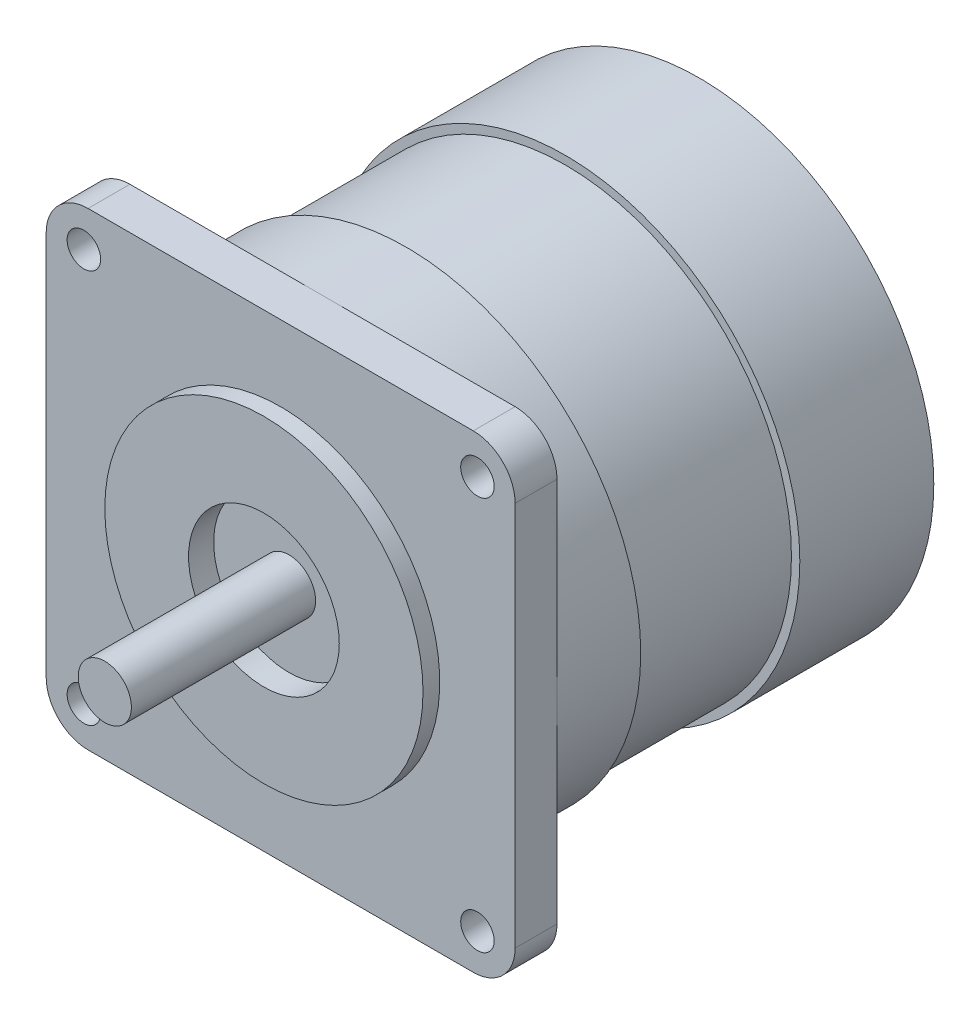
from build123d import *

# Parameters (mm, degrees)
ESQUISSE1_W             = 56
ESQUISSE1_H             = 56
BOSS_EXTRU_1_DEPTH      = 5
ESQUISSE3_R             = 19
BOSS_EXTRU_2_DEPTH      = 2
ESQUISSE4_R             = 9
ENL_V_MAT_EXTRU_1_DEPTH = 3
ESQUISSE5_R             = 3.175
BOSS_EXTRU_3_DEPTH      = 22
ENL_V_MAT_EXTRU_2_REACH = 65.781
ESQUISSE6_R             = 2
CONG_1_R                = 5


with BuildPart() as part:
    # Esquisse1 → Boss.-Extru.1 (new body)
    with BuildSketch(Plane.XY):
        Rectangle(ESQUISSE1_W, ESQUISSE1_H)
    extrude(amount=BOSS_EXTRU_1_DEPTH)

    # Esquisse2 → Révolution1 (revolve)
    with BuildSketch(Plane(origin=(0, 0, 0), x_dir=(1, 0, 0), z_dir=(0, 1, 0))):
        Polygon((0, 0), (28, 0), (28, 10), (27, 10), (27, 29), (28, 29), (28, 45), (0, 45), align=None)
    revolve(axis=Axis((0, 0, 0), (0, 0, -1)))

    # Esquisse3 → Boss.-Extru.2 (add)
    with BuildSketch(Plane.XY.offset(5)):
        with Locations(Location((0, 0, 0), (0, 0, 180))):
            Circle(ESQUISSE3_R)
    extrude(amount=BOSS_EXTRU_2_DEPTH)

    # Esquisse4 → Enlèv. mat.-Extru.1 (cut)
    with BuildSketch(Plane.XY.offset(7)):
        Circle(ESQUISSE4_R)
    extrude(amount=-ENL_V_MAT_EXTRU_1_DEPTH, mode=Mode.SUBTRACT)

    # Esquisse5 → Boss.-Extru.3 (add)
    with BuildSketch(Plane.XY.offset(4)):
        Circle(ESQUISSE5_R)
    extrude(amount=BOSS_EXTRU_3_DEPTH)

    # Esquisse6 → Enlèv. mat.-Extru.2 (cut, up to next)
    with BuildSketch(Plane.XY.offset(5), mode=Mode.PRIVATE) as enl_v_mat_extru_2_sk1:
        with Locations((23.5, 23.5)):
            Circle(ESQUISSE6_R)
    enl_v_mat_extru_2_tool1 = extrude(enl_v_mat_extru_2_sk1.sketch, amount=-ENL_V_MAT_EXTRU_2_REACH, mode=Mode.PRIVATE) & part.part
    # Esquisse6 → Enlèv. mat.-Extru.2 (cut, up to next)
    with BuildSketch(Plane.XY.offset(5), mode=Mode.PRIVATE) as enl_v_mat_extru_2_sk2:
        with Locations(Location((-23.5, 23.5, 0), (0, 0, 180))):
            Circle(ESQUISSE6_R)
    enl_v_mat_extru_2_tool2 = extrude(enl_v_mat_extru_2_sk2.sketch, amount=-ENL_V_MAT_EXTRU_2_REACH, mode=Mode.PRIVATE) & part.part
    # Esquisse6 → Enlèv. mat.-Extru.2 (cut, up to next)
    with BuildSketch(Plane.XY.offset(5), mode=Mode.PRIVATE) as enl_v_mat_extru_2_sk3:
        with Locations(Location((23.5, -23.5, 0), (0, 0, 180))):
            Circle(ESQUISSE6_R)
    enl_v_mat_extru_2_tool3 = extrude(enl_v_mat_extru_2_sk3.sketch, amount=-ENL_V_MAT_EXTRU_2_REACH, mode=Mode.PRIVATE) & part.part
    # Esquisse6 → Enlèv. mat.-Extru.2 (cut, up to next)
    with BuildSketch(Plane.XY.offset(5), mode=Mode.PRIVATE) as enl_v_mat_extru_2_sk4:
        with Locations((-23.5, -23.5)):
            Circle(ESQUISSE6_R)
    enl_v_mat_extru_2_tool4 = extrude(enl_v_mat_extru_2_sk4.sketch, amount=-ENL_V_MAT_EXTRU_2_REACH, mode=Mode.PRIVATE) & part.part
    add(enl_v_mat_extru_2_tool1.solids().sort_by_distance((23.5, 23.5, 5))[0], mode=Mode.SUBTRACT)
    add(enl_v_mat_extru_2_tool2.solids().sort_by_distance((-23.5, 23.5, 5))[0], mode=Mode.SUBTRACT)
    add(enl_v_mat_extru_2_tool3.solids().sort_by_distance((23.5, -23.5, 5))[0], mode=Mode.SUBTRACT)
    add(enl_v_mat_extru_2_tool4.solids().sort_by_distance((-23.5, -23.5, 5))[0], mode=Mode.SUBTRACT)

    # Congé1
    cong_1_edges = [part.edges().sort_by_distance(p)[0] for p in [
        (-28, 28, 2.5),
        (28, 28, 2.5),
        (28, -28, 2.5),
        (-28, -28, 2.5),
    ]]
    fillet(cong_1_edges, radius=CONG_1_R)


solid = part.part
